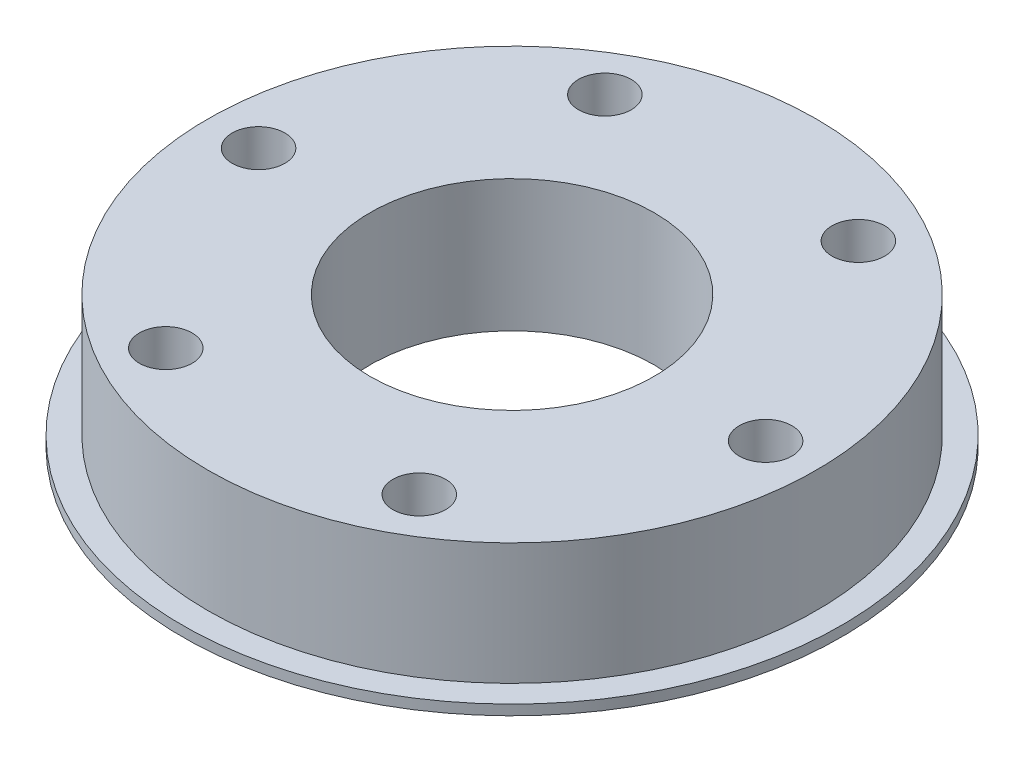
from build123d import *

# Parameters (mm, degrees)
SKETCH1_R           = 30
BOSS_EXTRUDE1_DEPTH = 13
SKETCH2_R           = 32.5
BOSS_EXTRUDE2_DEPTH = 1
SKETCH3_R           = 1.6
CUT_EXTRUDE1_DEPTH  = 3.5
SKETCH4_R           = 14
CUT_EXTRUDE2_DEPTH  = 51
SKETCH5_R           = 2.6
CUT_EXTRUDE3_DEPTH  = 25


with BuildPart() as part:
    # Sketch1 → Boss-Extrude1 (new body)
    with BuildSketch(Plane(origin=(0, 0, 0), x_dir=(1, 0, 0), z_dir=(0, 1, 0))):
        with Locations(Location((0, 0, 0), (0, 0, 90))):
            Circle(SKETCH1_R)
    extrude(amount=BOSS_EXTRUDE1_DEPTH)

    # Sketch2 → Boss-Extrude2 (add)
    with BuildSketch(Plane.XZ):
        with Locations(Location((0, 0, 0), (0, 0, 270))):
            Circle(SKETCH2_R)
    extrude(amount=-BOSS_EXTRUDE2_DEPTH)

    # Sketch3 → Cut-Extrude1 (cut)
    with BuildSketch(Plane(origin=(0, 0, 0), x_dir=(1, 0, 0), z_dir=(0, 1, 0))):
        with Locations(Location((0, 25, 0), (0, 0, 270))):
            Circle(SKETCH3_R)
        with Locations(Location((21.650635095, 12.5, 0), (0, 0, 270))):
            Circle(SKETCH3_R)
        with Locations(Location((21.650635095, -12.5, 0), (0, 0, 270))):
            Circle(SKETCH3_R)
        with Locations(Location((0, -25, 0), (0, 0, 270))):
            Circle(SKETCH3_R)
        with Locations(Location((-21.650635095, -12.5, 0), (0, 0, 270))):
            Circle(SKETCH3_R)
        with Locations(Location((-21.650635095, 12.5, 0), (0, 0, 270))):
            Circle(SKETCH3_R)
    extrude(amount=CUT_EXTRUDE1_DEPTH, mode=Mode.SUBTRACT)

    # Sketch4 → Cut-Extrude2 (cut)
    with BuildSketch(Plane.XZ):
        with Locations(Location((0, 0, 0), (0, 0, 270))):
            Circle(SKETCH4_R)
    extrude(amount=-CUT_EXTRUDE2_DEPTH, mode=Mode.SUBTRACT)

    # Sketch5 → Cut-Extrude3 (cut)
    with BuildSketch(Plane.XZ):
        with Locations(Location((-12.5, 21.650635095, 0), (0, 0, 270))):
            Circle(SKETCH5_R)
        with Locations(Location((12.5, 21.650635095, 0), (0, 0, 270))):
            Circle(SKETCH5_R)
        with Locations(Location((25, 0, 0), (0, 0, 270))):
            Circle(SKETCH5_R)
        with Locations(Location((12.5, -21.650635095, 0), (0, 0, 270))):
            Circle(SKETCH5_R)
        with Locations(Location((-12.5, -21.650635095, 0), (0, 0, 270))):
            Circle(SKETCH5_R)
        with Locations(Location((-25, 0, 0), (0, 0, 270))):
            Circle(SKETCH5_R)
    extrude(amount=-CUT_EXTRUDE3_DEPTH, mode=Mode.SUBTRACT)


solid = part.part
